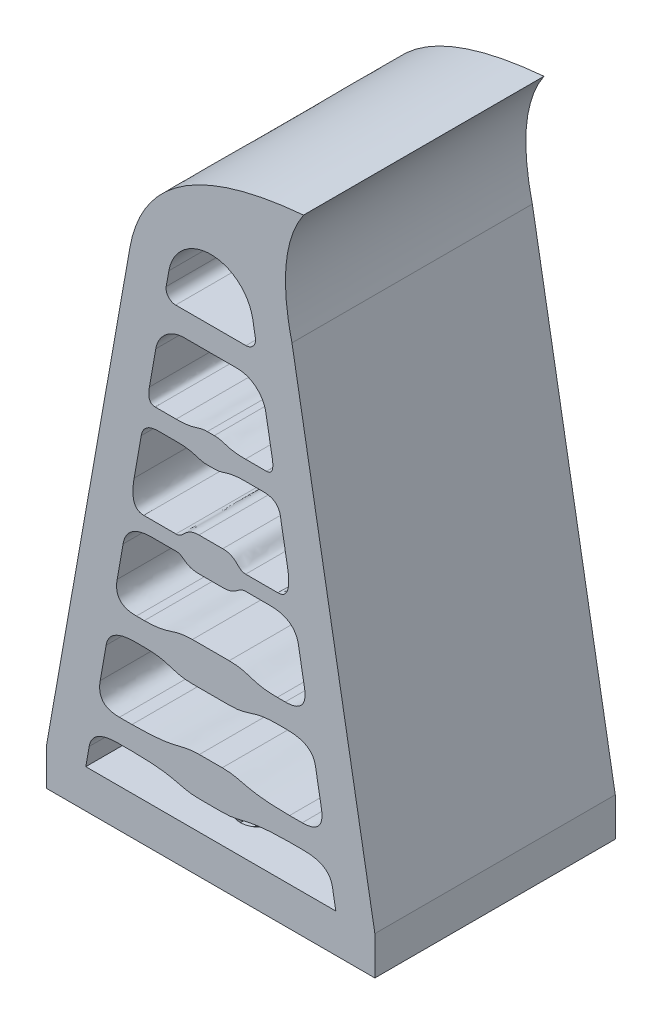
from build123d import *

# Parameters (mm, degrees)
BOSS_EXTRUDE1_DEPTH = 25
FILLET1_R           = 1
FILLET2_R           = 3
CUT_EXTRUDE2_REACH  = 73.701
SKETCH7_R           = 1
CUT_EXTRUDE3_START  = -2
SKETCH9_R           = 2
SKETCH9_R_2         = 1
CUT_EXTRUDE3_DEPTH  = 2


with BuildPart() as part:
    # Sketch2 → Boss-Extrude1 (new body)
    with BuildSketch(Plane.XY):
        with BuildLine():
            Line((17.061706448, 4), (8.440686006, 52.892236495))
            add(Edge.make_bspline(
                [(9.643502913, 65), (6.628034622, 60.498115288), (8.440686006, 52.892236495)],
                knots=[0, 0, 0, 1, 1, 1], degree=2))
            add(Edge.make_bspline(
                [(-8.425729272, 52.977060348), (-6.557164897, 63.574215518), (9.643502913, 65)],
                knots=[0, 0, 0, 1, 1, 1], degree=2))
            Line((-8.425729272, 52.977060348), (-17.061706448, 4))
            Line((-17.061706448, 4), (-17.061706448, 0))
            Line((-17.061706448, 0), (17.061706448, 0))
            Line((17.061706448, 0), (17.061706448, 4))
        make_face()
        with BuildLine():
            Line((1.236290995, 30.75), (-1.236290995, 30.75))
            add(Edge.make_bspline(
                [(-1.236290995, 30.75), (-2.736290995, 30.75), (-2.736290995, 29.65), (-3.622974644, 29.65)],
                knots=[0, 0, 0, 0, 1, 1, 1, 1], degree=3))
            Line((-3.622974644, 29.65), (-6.97468105, 29.65))
            add(Edge.make_bspline(
                [(-6.97468105, 29.65), (-8.477212945, 29.65), (-7.97468105, 32.5)],
                knots=[0, 0, 0, 1, 1, 1], degree=2))
            Line((-7.97468105, 32.5), (-7.234107731, 36.7))
            add(Edge.make_bspline(
                [(-5.434107731, 38), (-7.004882656, 38), (-7.234107731, 36.7)],
                knots=[0, 0, 0, 1, 1, 1], degree=2))
            Line((-5.434107731, 38), (-3.602272808, 38))
            add(Edge.make_bspline(
                [(-0.366804006, 37.5), (-1.466804006, 37.5), (-1.466804006, 38), (-3.602272808, 38)],
                knots=[0, 0, 0, 0, 1, 1, 1, 1], degree=3))
            Line((-0.366804006, 37.5), (0.366804006, 37.5))
            add(Edge.make_bspline(
                [(0.366804006, 37.5), (1.466804006, 37.5), (1.466804006, 38), (3.602272808, 38)],
                knots=[0, 0, 0, 0, 1, 1, 1, 1], degree=3))
            Line((3.602272808, 38), (5.434107731, 38))
            add(Edge.make_bspline(
                [(5.434107731, 38), (7.004882656, 38), (7.234107731, 36.7)],
                knots=[0, 0, 0, 1, 1, 1], degree=2))
            Line((7.234107731, 36.7), (7.97468105, 32.5))
            add(Edge.make_bspline(
                [(6.97468105, 29.65), (8.477212945, 29.65), (7.97468105, 32.5)],
                knots=[0, 0, 0, 1, 1, 1], degree=2))
            Line((6.97468105, 29.65), (3.622974644, 29.65))
            add(Edge.make_bspline(
                [(1.236290995, 30.75), (2.736290995, 30.75), (2.736290995, 29.65), (3.622974644, 29.65)],
                knots=[0, 0, 0, 0, 1, 1, 1, 1], degree=3))
        make_face(mode=Mode.SUBTRACT)
        with BuildLine():
            Line((-4.363327719, 52.981002491), (-4.844877142, 50.25))
            Line((-4.844877142, 50.25), (4.844877142, 50.25))
            Line((4.844877142, 50.25), (4.363327719, 52.981002491))
            ThreePointArc((4.363327719, 52.981002491), (0, 56.642269171), (-4.363327719, 52.981002491))
        make_face(mode=Mode.SUBTRACT)
        with BuildLine():
            Line((-3.622974644, 28.1), (-6.120806424, 28.1))
            add(Edge.make_bspline(
                [(-6.120806424, 28.1), (-8.750519765, 28.1), (-9.120806424, 26)],
                knots=[0, 0, 0, 1, 1, 1], degree=2))
            Line((-9.120806424, 26), (-9.737950857, 22.5))
            add(Edge.make_bspline(
                [(-7.737950857, 20.2), (-10.143502913, 20.2), (-9.737950857, 22.5)],
                knots=[0, 0, 0, 1, 1, 1], degree=2))
            Line((-7.737950857, 20.2), (-6.910352532, 20.2))
            add(Edge.make_bspline(
                [(-1.910352532, 21), (-4.110352532, 21), (-4.110352532, 20.2), (-6.910352532, 20.2)],
                knots=[0, 0, 0, 0, 1, 1, 1, 1], degree=3))
            Line((-1.910352532, 21), (1.910352532, 21))
            add(Edge.make_bspline(
                [(1.910352532, 21), (4.110352532, 21), (4.110352532, 20.2), (6.910352532, 20.2)],
                knots=[0, 0, 0, 0, 1, 1, 1, 1], degree=3))
            Line((6.910352532, 20.2), (7.737950857, 20.2))
            add(Edge.make_bspline(
                [(7.737950857, 20.2), (10.143502913, 20.2), (9.737950857, 22.5)],
                knots=[0, 0, 0, 1, 1, 1], degree=2))
            Line((9.737950857, 22.5), (9.120806424, 26))
            add(Edge.make_bspline(
                [(6.120806424, 28.1), (8.750519765, 28.1), (9.120806424, 26)],
                knots=[0, 0, 0, 1, 1, 1], degree=2))
            Line((6.120806424, 28.1), (3.622974644, 28.1))
            add(Edge.make_bspline(
                [(1.236290995, 27.25), (2.736290995, 27.25), (2.736290995, 28.1), (3.622974644, 28.1)],
                knots=[0, 0, 0, 0, 1, 1, 1, 1], degree=3))
            Line((1.236290995, 27.25), (-1.236290995, 27.25))
            add(Edge.make_bspline(
                [(-1.236290995, 27.25), (-2.736290995, 27.25), (-2.736290995, 28.1), (-3.622974644, 28.1)],
                knots=[0, 0, 0, 0, 1, 1, 1, 1], degree=3))
        make_face(mode=Mode.SUBTRACT)
        with BuildLine():
            Line((0.366804006, 40.5), (-0.366804006, 40.5))
            add(Edge.make_bspline(
                [(-0.366804006, 40.5), (-1.466804006, 40.5), (-1.466804006, 40), (-3.602272808, 40)],
                knots=[0, 0, 0, 0, 1, 1, 1, 1], degree=3))
            Line((-3.602272808, 40), (-5.787738223, 40))
            add(Edge.make_bspline(
                [(-5.787738223, 40), (-6.652228694, 40), (-6.387738223, 41.5)],
                knots=[0, 0, 0, 1, 1, 1], degree=2))
            Line((-6.387738223, 41.5), (-5.285694594, 47.75))
            Line((-5.285694594, 47.75), (5.285694594, 47.75))
            Line((5.285694594, 47.75), (6.387738223, 41.5))
            add(Edge.make_bspline(
                [(5.787738223, 40), (6.652228694, 40), (6.387738223, 41.5)],
                knots=[0, 0, 0, 1, 1, 1], degree=2))
            Line((5.787738223, 40), (3.602272808, 40))
            add(Edge.make_bspline(
                [(0.366804006, 40.5), (1.466804006, 40.5), (1.466804006, 40), (3.602272808, 40)],
                knots=[0, 0, 0, 0, 1, 1, 1, 1], degree=3))
        make_face(mode=Mode.SUBTRACT)
        with BuildLine():
            Line((12.647346039, 6), (13, 4))
            Line((13, 4), (-13, 4))
            Line((-13, 4), (-12.647346039, 6))
            add(Edge.make_bspline(
                [(-9.647346039, 7.8), (-12.329957473, 7.8), (-12.647346039, 6)],
                knots=[0, 0, 0, 1, 1, 1], degree=2))
            Line((-9.647346039, 7.8), (-8.192983187, 7.8))
            add(Edge.make_bspline(
                [(-1.192983187, 7), (-3.392983187, 7), (-3.392983187, 7.8), (-8.192983187, 7.8)],
                knots=[0, 0, 0, 0, 1, 1, 1, 1], degree=3))
            Line((-1.192983187, 7), (1.192983187, 7))
            add(Edge.make_bspline(
                [(1.192983187, 7), (3.392983187, 7), (3.392983187, 7.8), (8.192983187, 7.8)],
                knots=[0, 0, 0, 0, 1, 1, 1, 1], degree=3))
            Line((8.192983187, 7.8), (9.647346039, 7.8))
            add(Edge.make_bspline(
                [(9.647346039, 7.8), (12.329957473, 7.8), (12.647346039, 6)],
                knots=[0, 0, 0, 1, 1, 1], degree=2))
        make_face(mode=Mode.SUBTRACT)
        with BuildLine():
            Line((-10.884076231, 16), (-11.501220664, 12.5))
            add(Edge.make_bspline(
                [(-9.501220664, 10.2), (-11.90677272, 10.2), (-11.501220664, 12.5)],
                knots=[0, 0, 0, 1, 1, 1], degree=2))
            Line((-9.501220664, 10.2), (-8.192983187, 10.2))
            add(Edge.make_bspline(
                [(-1.192983187, 11), (-3.392983187, 11), (-3.392983187, 10.2), (-8.192983187, 10.2)],
                knots=[0, 0, 0, 0, 1, 1, 1, 1], degree=3))
            Line((-1.192983187, 11), (1.192983187, 11))
            add(Edge.make_bspline(
                [(1.192983187, 11), (3.392983187, 11), (3.392983187, 10.2), (8.192983187, 10.2)],
                knots=[0, 0, 0, 0, 1, 1, 1, 1], degree=3))
            Line((8.192983187, 10.2), (9.501220664, 10.2))
            add(Edge.make_bspline(
                [(9.501220664, 10.2), (11.90677272, 10.2), (11.501220664, 12.5)],
                knots=[0, 0, 0, 1, 1, 1], degree=2))
            Line((11.501220664, 12.5), (10.884076231, 16))
            add(Edge.make_bspline(
                [(7.884076231, 17.8), (10.566687666, 17.8), (10.884076231, 16)],
                knots=[0, 0, 0, 1, 1, 1], degree=2))
            Line((7.884076231, 17.8), (6.910352532, 17.8))
            add(Edge.make_bspline(
                [(1.910352532, 17), (4.110352532, 17), (4.110352532, 17.8), (6.910352532, 17.8)],
                knots=[0, 0, 0, 0, 1, 1, 1, 1], degree=3))
            Line((1.910352532, 17), (-1.910352532, 17))
            add(Edge.make_bspline(
                [(-1.910352532, 17), (-4.110352532, 17), (-4.110352532, 17.8), (-6.910352532, 17.8)],
                knots=[0, 0, 0, 0, 1, 1, 1, 1], degree=3))
            Line((-6.910352532, 17.8), (-7.884076231, 17.8))
            add(Edge.make_bspline(
                [(-7.884076231, 17.8), (-10.566687666, 17.8), (-10.884076231, 16)],
                knots=[0, 0, 0, 1, 1, 1], degree=2))
        make_face(mode=Mode.SUBTRACT)
    extrude(amount=BOSS_EXTRUDE1_DEPTH)

    # Fillet1
    fillet1_edges = [part.edges().sort_by_distance(p)[0] for p in [
        (-4.844877142, 50.25, 12.5),
        (4.844877142, 50.25, 12.5),
    ]]
    fillet(fillet1_edges, radius=FILLET1_R)

    # Fillet2
    fillet2_edges = [part.edges().sort_by_distance(p)[0] for p in [
        (5.285694594, 47.75, 12.5),
        (-5.285694594, 47.75, 12.5),
    ]]
    fillet(fillet2_edges, radius=FILLET2_R)

    # Sketch7 → Cut-Extrude2 (cut, up to next)
    with BuildSketch(Plane.XZ, mode=Mode.PRIVATE) as cut_extrude2_sk1:
        with Locations(Location((-7.438293552, 12.5, 0), (0, 0, 270))):
            Circle(SKETCH7_R)
    cut_extrude2_tool1 = extrude(cut_extrude2_sk1.sketch, amount=-CUT_EXTRUDE2_REACH, mode=Mode.PRIVATE) & part.part
    # Sketch7 → Cut-Extrude2 (cut, up to next)
    with BuildSketch(Plane.XZ, mode=Mode.PRIVATE) as cut_extrude2_sk2:
        with Locations(Location((0.061706448, 20, 0), (0, 0, 270))):
            Circle(SKETCH7_R)
    cut_extrude2_tool2 = extrude(cut_extrude2_sk2.sketch, amount=-CUT_EXTRUDE2_REACH, mode=Mode.PRIVATE) & part.part
    # Sketch7 → Cut-Extrude2 (cut, up to next)
    with BuildSketch(Plane.XZ, mode=Mode.PRIVATE) as cut_extrude2_sk3:
        with Locations(Location((7.561706448, 12.5, 0), (0, 0, 270))):
            Circle(SKETCH7_R)
    cut_extrude2_tool3 = extrude(cut_extrude2_sk3.sketch, amount=-CUT_EXTRUDE2_REACH, mode=Mode.PRIVATE) & part.part
    # Sketch7 → Cut-Extrude2 (cut, up to next)
    with BuildSketch(Plane.XZ, mode=Mode.PRIVATE) as cut_extrude2_sk4:
        with Locations(Location((0.061706448, 5, 0), (0, 0, 270))):
            Circle(SKETCH7_R)
    cut_extrude2_tool4 = extrude(cut_extrude2_sk4.sketch, amount=-CUT_EXTRUDE2_REACH, mode=Mode.PRIVATE) & part.part
    add(cut_extrude2_tool1.solids().sort_by_distance((-7.438294, 0, 12.5))[0], mode=Mode.SUBTRACT)
    add(cut_extrude2_tool2.solids().sort_by_distance((0.061706, 0, 20))[0], mode=Mode.SUBTRACT)
    add(cut_extrude2_tool3.solids().sort_by_distance((7.561706, 0, 12.5))[0], mode=Mode.SUBTRACT)
    add(cut_extrude2_tool4.solids().sort_by_distance((0.061706, 0, 5))[0], mode=Mode.SUBTRACT)

    # Sketch9 → Cut-Extrude3 (cut)
    # profile 1 of 4: a face of its own
    with BuildSketch(Plane(origin=(0, 4, 0), x_dir=(1, 0, 0), z_dir=(0, 1, 0)).offset(CUT_EXTRUDE3_START)):
        with Locations(Location((0.061706448, -5, 0), (0, 0, 270))):
            Circle(SKETCH9_R)
        with Locations(Location((0.061706448, -5, 0), (0, 0, 90))):
            Circle(SKETCH9_R_2, mode=Mode.SUBTRACT)
    # profile 2 of 4: a face of its own
    with BuildSketch(Plane(origin=(0, 4, 0), x_dir=(1, 0, 0), z_dir=(0, 1, 0)).offset(CUT_EXTRUDE3_START)):
        with Locations(Location((7.561706448, -12.5, 0), (0, 0, 270))):
            Circle(SKETCH9_R)
        with Locations(Location((7.561706448, -12.5, 0), (0, 0, 90))):
            Circle(SKETCH9_R_2, mode=Mode.SUBTRACT)
    # profile 3 of 4: a face of its own
    with BuildSketch(Plane(origin=(0, 4, 0), x_dir=(1, 0, 0), z_dir=(0, 1, 0)).offset(CUT_EXTRUDE3_START)):
        with Locations(Location((0.061706448, -20, 0), (0, 0, 270))):
            Circle(SKETCH9_R)
        with Locations(Location((0.061706448, -20, 0), (0, 0, 90))):
            Circle(SKETCH9_R_2, mode=Mode.SUBTRACT)
    # profile 4 of 4: a face of its own
    with BuildSketch(Plane(origin=(0, 4, 0), x_dir=(1, 0, 0), z_dir=(0, 1, 0)).offset(CUT_EXTRUDE3_START)):
        with Locations(Location((-7.438293552, -12.5, 0), (0, 0, 270))):
            Circle(SKETCH9_R)
        with Locations(Location((-7.438293552, -12.5, 0), (0, 0, 90))):
            Circle(SKETCH9_R_2, mode=Mode.SUBTRACT)
    extrude(amount=CUT_EXTRUDE3_DEPTH, mode=Mode.SUBTRACT)


solid = part.part
